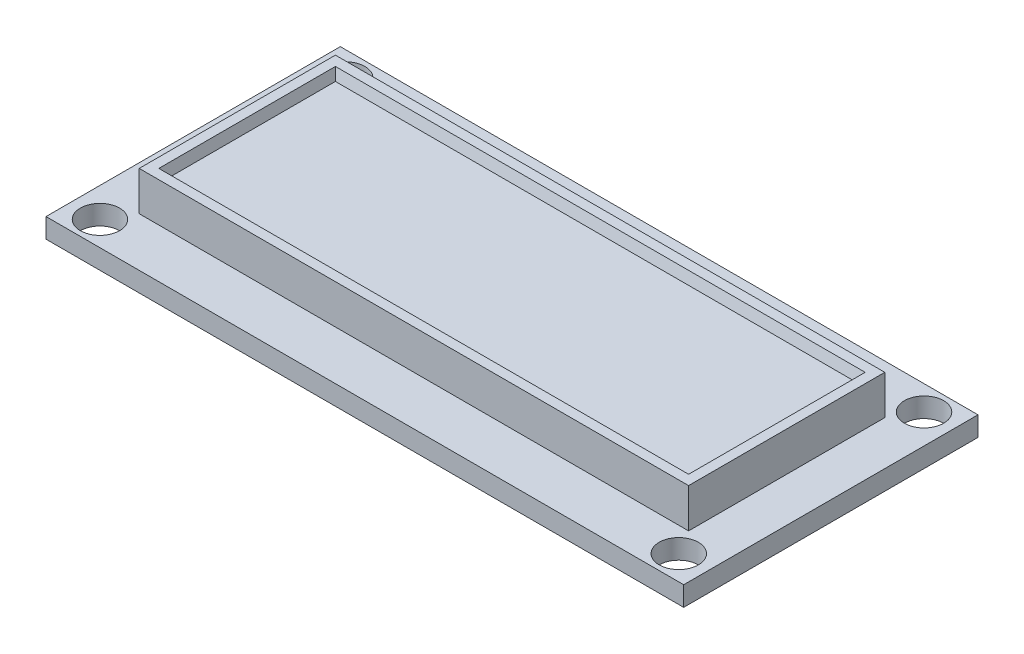
from build123d import *

# Parameters (mm, degrees)
SKETCH2_W           = 82.55
SKETCH2_H           = 38.1
BOSS_EXTRUDE1_DEPTH = 2.54
SKETCH3_W           = 71.12
SKETCH3_H           = 25.4
BOSS_EXTRUDE2_DEPTH = 5.08
SKETCH4_W           = 68.58
SKETCH4_H           = 22.86
CUT_EXTRUDE1_DEPTH  = 1.27
CUT_EXTRUDE1_DRAFT  = -18
SKETCH5_R           = 2.54
CUT_EXTRUDE2_DEPTH  = 2.54


with BuildPart() as part:
    # Sketch2 → Boss-Extrude1 (new body)
    with BuildSketch(Plane(origin=(0, 0, 0), x_dir=(1, 0, 0), z_dir=(0, 1, 0))):
        Rectangle(SKETCH2_W, SKETCH2_H)
    extrude(amount=BOSS_EXTRUDE1_DEPTH)

    # Sketch3 → Boss-Extrude2 (add)
    with BuildSketch(Plane(origin=(0, 2.54, 0), x_dir=(1, 0, 0), z_dir=(0, 1, 0))):
        Rectangle(SKETCH3_W, SKETCH3_H)
    extrude(amount=BOSS_EXTRUDE2_DEPTH)


with BuildPart() as cut_extrude1_tool:
    # Sketch4 → Cut-Extrude1 (with draft: the straight prism first)
    with BuildSketch(Plane(origin=(0, 7.62, 0), x_dir=(1, 0, 0), z_dir=(0, 1, 0))):
        Rectangle(SKETCH4_W, SKETCH4_H)
    extrude(amount=-CUT_EXTRUDE1_DEPTH)
    # Cut-Extrude1: the draft: its side faces are tilted about the plane it starts from
    cut_extrude1_sides = [cut_extrude1_tool.faces().sort_by_distance(p)[0] for p in [
        (-34.29, 6.985, 0),
        (0, 6.985, 11.43),
        (34.29, 6.985, 0),
        (0, 6.985, -11.43),
    ]]
    draft(cut_extrude1_sides, Plane(origin=(0, 7.62, 0), x_dir=(1, 0, 0), z_dir=(0, 1, 0)), CUT_EXTRUDE1_DRAFT)


with BuildPart() as part_1:
    add(part.part)

    # Cut-Extrude1: cut by cut_extrude1_tool
    add(cut_extrude1_tool.part, mode=Mode.SUBTRACT)

    # Sketch5 → Cut-Extrude2 (cut)
    with BuildSketch(Plane(origin=(0, 2.54, 0), x_dir=(1, 0, 0), z_dir=(0, 1, 0))):
        with Locations((-37.465, 15.875)):
            Circle(SKETCH5_R)
        with Locations((-37.465, -15.875)):
            Circle(SKETCH5_R)
        with Locations((37.465, -15.875)):
            Circle(SKETCH5_R)
        with Locations((37.465, 15.875)):
            Circle(SKETCH5_R)
    extrude(amount=-CUT_EXTRUDE2_DEPTH, mode=Mode.SUBTRACT)


solid = part_1.part
